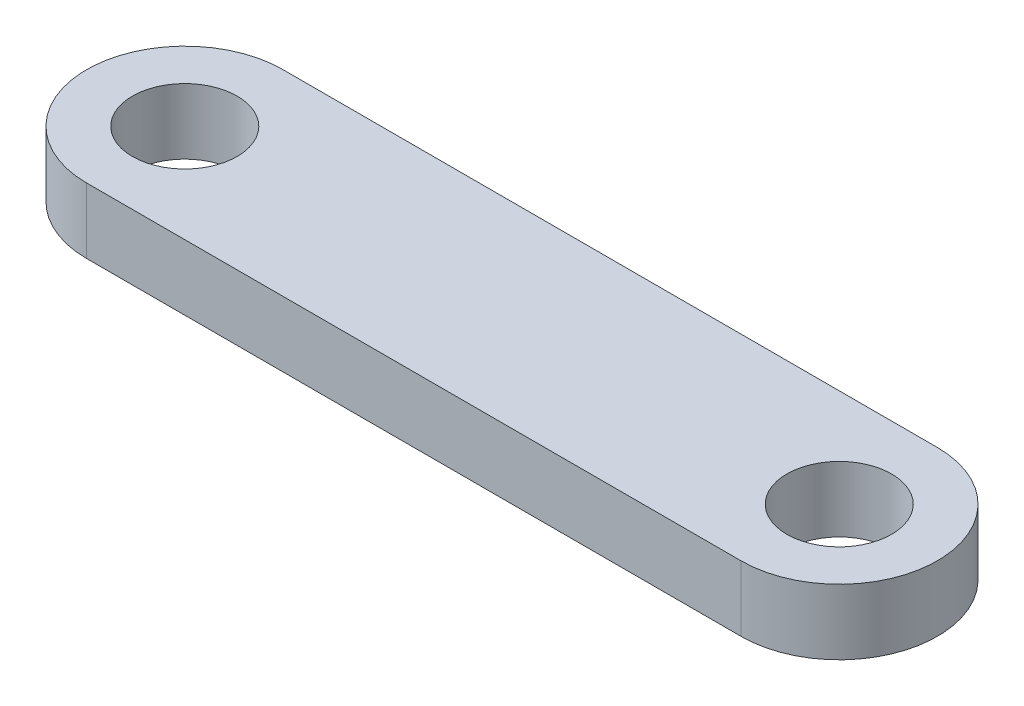
from build123d import *

# Parameters (mm, degrees)
SKETCH1_R           = 4
BOSS_EXTRUDE1_DEPTH = 5
SCALE1_SCALE        = 0.7


with BuildPart() as part:
    # Sketch1 → Boss-Extrude1 (new body)
    with BuildSketch(Plane(origin=(0, 0, 0), x_dir=(1, 0, 0), z_dir=(0, 1, 0))):
        with BuildLine():
            Line((0, 7.5), (50, 7.5))
            ThreePointArc((50, 7.5), (57.5, 0), (50, -7.5))
            Line((50, -7.5), (0, -7.5))
            ThreePointArc((0, -7.5), (-7.5, 0), (0, 7.5))
        make_face()
        with Locations(Location((0, 0, 0), (0, 0, 270))):
            Circle(SKETCH1_R, mode=Mode.SUBTRACT)
        with Locations(Location((50, 0, 0), (0, 0, 270))):
            Circle(SKETCH1_R, mode=Mode.SUBTRACT)
    extrude(amount=BOSS_EXTRUDE1_DEPTH)


with BuildPart() as part_1:
    # Scale1: scaled about (25, 2.5, 0)
    add(part.part.scale(SCALE1_SCALE).moved(Location((7.5, 0.75, 0))))


solid = part_1.part
